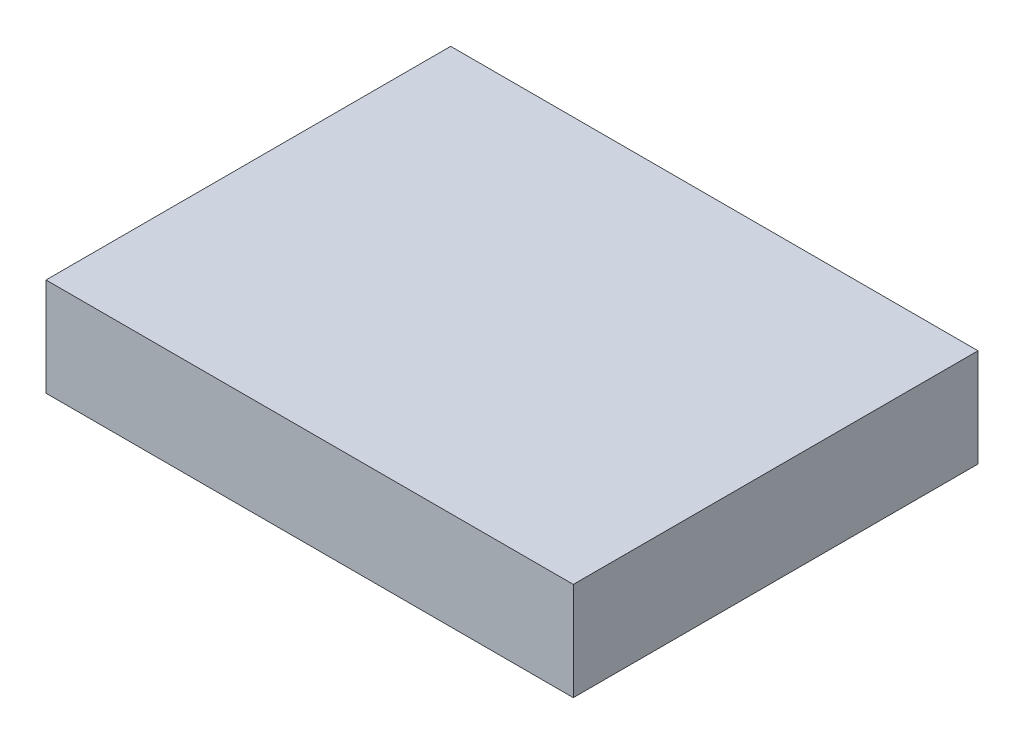
from build123d import *

# Parameters (mm, degrees)
SKETCH1_W           = 86
SKETCH1_H           = 66
BOSS_EXTRUDE1_DEPTH = 16
SKETCH2_W           = 81.2
SKETCH2_H           = 61.2
CUT_EXTRUDE1_DEPTH  = 13.6


with BuildPart() as part:
    # Sketch1 → Boss-Extrude1 (new body)
    with BuildSketch(Plane(origin=(0, 0, 0), x_dir=(1, 0, 0), z_dir=(0, 1, 0))):
        Rectangle(SKETCH1_W, SKETCH1_H)
    extrude(amount=BOSS_EXTRUDE1_DEPTH)

    # Sketch2 → Cut-Extrude1 (cut)
    with BuildSketch(Plane.XZ):
        Rectangle(SKETCH2_W, SKETCH2_H)
    extrude(amount=-CUT_EXTRUDE1_DEPTH, mode=Mode.SUBTRACT)


solid = part.part
